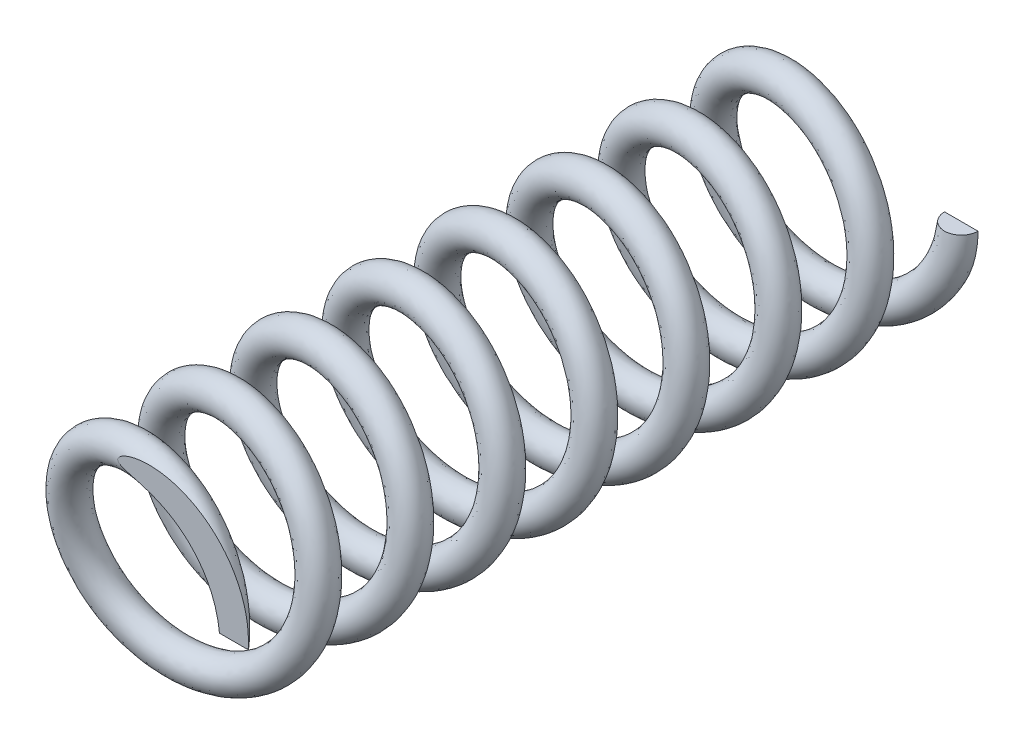
from build123d import *

# Parameters (mm, degrees)
SWEEP_1_PITCH            = 2.75
SWEEP_1_HEIGHT           = 22
SWEEP_1_RADIUS           = 3
SKETCH_2_R               = 0.5
CUT_EXTRUDE_1_DEPTH      = 24.038012164
CUT_EXTRUDE_1_DEPTH_BACK = 24.038012164
SKETCH_3_W               = 10.325530474
SKETCH_3_H               = 1.049398907


with BuildPart() as part:
    # 扫描1: sweep along a helix
    with BuildLine() as sweep_1_path:
        Helix(SWEEP_1_PITCH, SWEEP_1_HEIGHT, SWEEP_1_RADIUS, center=(0, 0, 0), direction=(0, 0, 1), lefthand=True)
    # 草图2 → 扫描1 (sweep)
    with BuildSketch(Plane(origin=(0, 0, 0), x_dir=(1, 0, 0), z_dir=(0, 1, 0))):
        with Locations((3, 0)):
            Circle(SKETCH_2_R)
    sweep(path=sweep_1_path.line, is_frenet=True)

    # 草图3 → 切除-拉伸1 (cut, two sides: drawn at the far end of the back side and taken through both)
    with BuildSketch(Plane(origin=(0, 0, 0), x_dir=(1, 0, 0), z_dir=(0, 1, 0)).offset(-CUT_EXTRUDE_1_DEPTH_BACK)):
        Polygon((2.4968198, -21.742817469), (-7.086000981, -21.742817469), (-7.086000981, -25.550853348), (4.884788019, -25.550853348), (4.884788019, -21.742817469), align=None)
        with Locations((0.357189958, 0.524699454)):
            Rectangle(SKETCH_3_W, SKETCH_3_H)
    extrude(amount=CUT_EXTRUDE_1_DEPTH + CUT_EXTRUDE_1_DEPTH_BACK, mode=Mode.SUBTRACT)


solid = part.part
